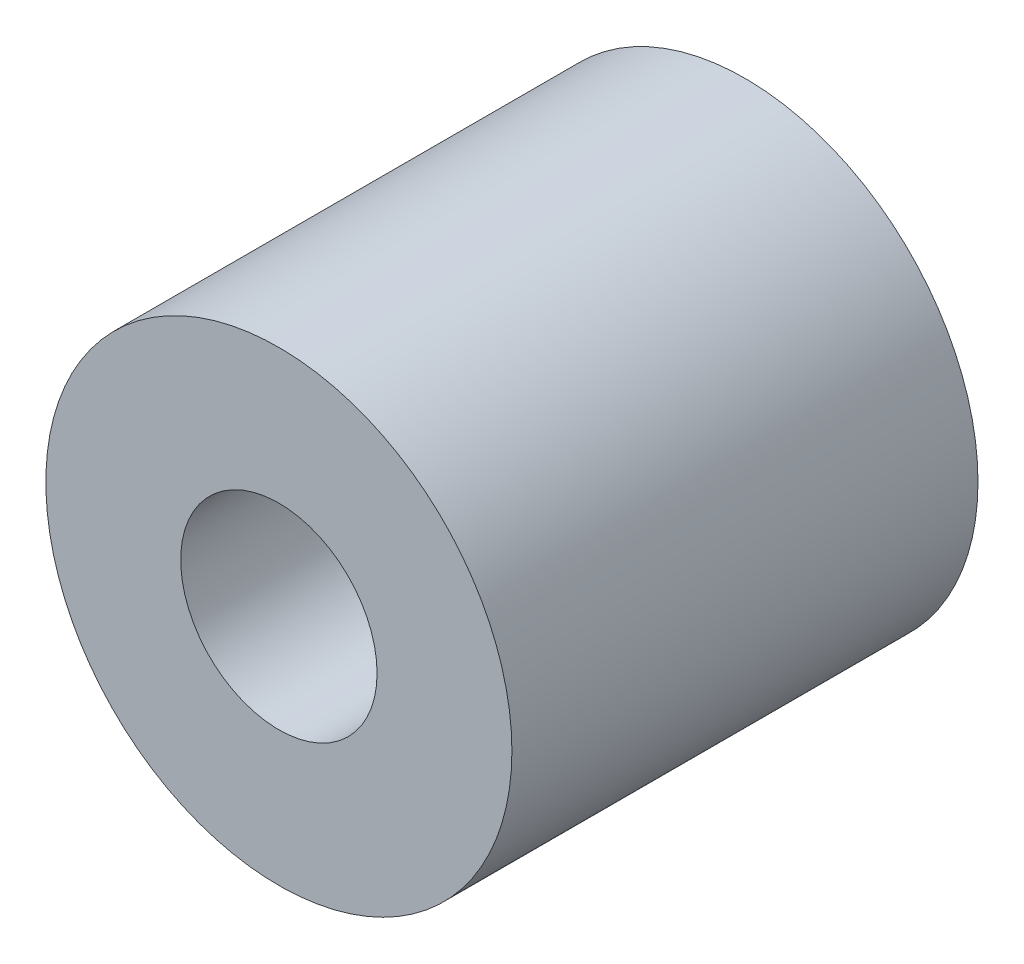
from build123d import *

# Parameters (mm, degrees)
SKETCH1_R           = 7.5
BOSS_EXTRUDE1_DEPTH = 15
SKETCH2_R           = 3.160012866
CUT_EXTRUDE1_DEPTH  = 15


with BuildPart() as part:
    # Sketch1 → Boss-Extrude1 (new body)
    with BuildSketch(Plane.XY):
        with Locations((113.00537488, -113.00537488)):
            Circle(SKETCH1_R)
    extrude(amount=BOSS_EXTRUDE1_DEPTH)

    # Sketch2 → Cut-Extrude1 (cut)
    with BuildSketch(Plane.XY.offset(15)):
        with Locations((113.00537488, -113.00537488)):
            Circle(SKETCH2_R)
    extrude(amount=-CUT_EXTRUDE1_DEPTH, mode=Mode.SUBTRACT)


solid = part.part
